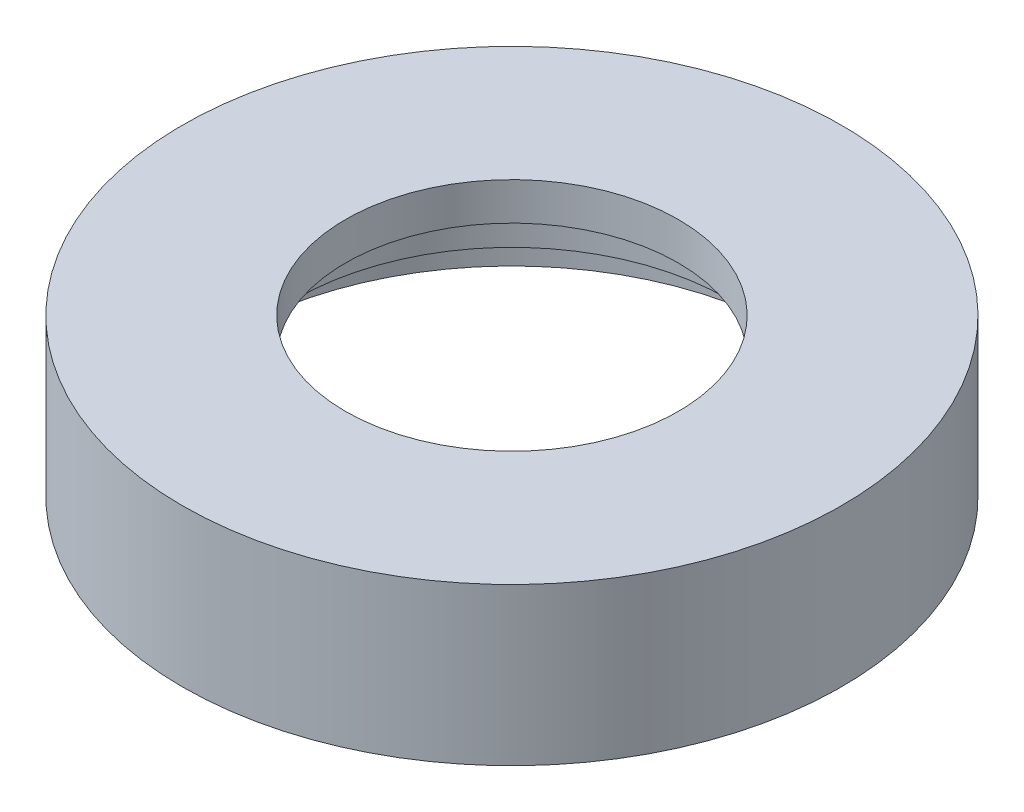
from build123d import *

# Parameters (mm, degrees)
SKETCH1_R           = 52.5
BOSS_EXTRUDE1_DEPTH = 12.5
SKETCH3_R           = 45
CUT_EXTRUDE1_DEPTH  = 10
SKETCH4_R           = 34.5
CUT_EXTRUDE2_DEPTH  = 9
SKETCH5_R           = 26.5
CUT_EXTRUDE3_DEPTH  = 22


with BuildPart() as part:
    # Sketch1 → Boss-Extrude1 (new, symmetric)
    with BuildSketch(Plane(origin=(0, 0, 0), x_dir=(-1, 0, 0), z_dir=(0, 1, 0))):
        with Locations(Location((0, 0, 0), (0, 0, 90))):
            Circle(SKETCH1_R)
    extrude(amount=BOSS_EXTRUDE1_DEPTH, both=True)

    # Sketch3 → Cut-Extrude1 (cut)
    with BuildSketch(Plane.XZ.offset(12.5)):
        with Locations(Location((0, 0, 0), (0, 0, 270))):
            Circle(SKETCH3_R)
    extrude(amount=-CUT_EXTRUDE1_DEPTH, mode=Mode.SUBTRACT)

    # Sketch4 → Cut-Extrude2 (cut)
    with BuildSketch(Plane.XZ.offset(2.5)):
        with Locations(Location((0, 0, 0), (0, 0, 270))):
            Circle(SKETCH4_R)
    extrude(amount=-CUT_EXTRUDE2_DEPTH, mode=Mode.SUBTRACT)

    # Sketch5 → Cut-Extrude3 (cut)
    with BuildSketch(Plane.XZ.offset(-6.5)):
        with Locations(Location((0, 0, 0), (0, 0, 270))):
            Circle(SKETCH5_R)
    extrude(amount=-CUT_EXTRUDE3_DEPTH, mode=Mode.SUBTRACT)


solid = part.part
